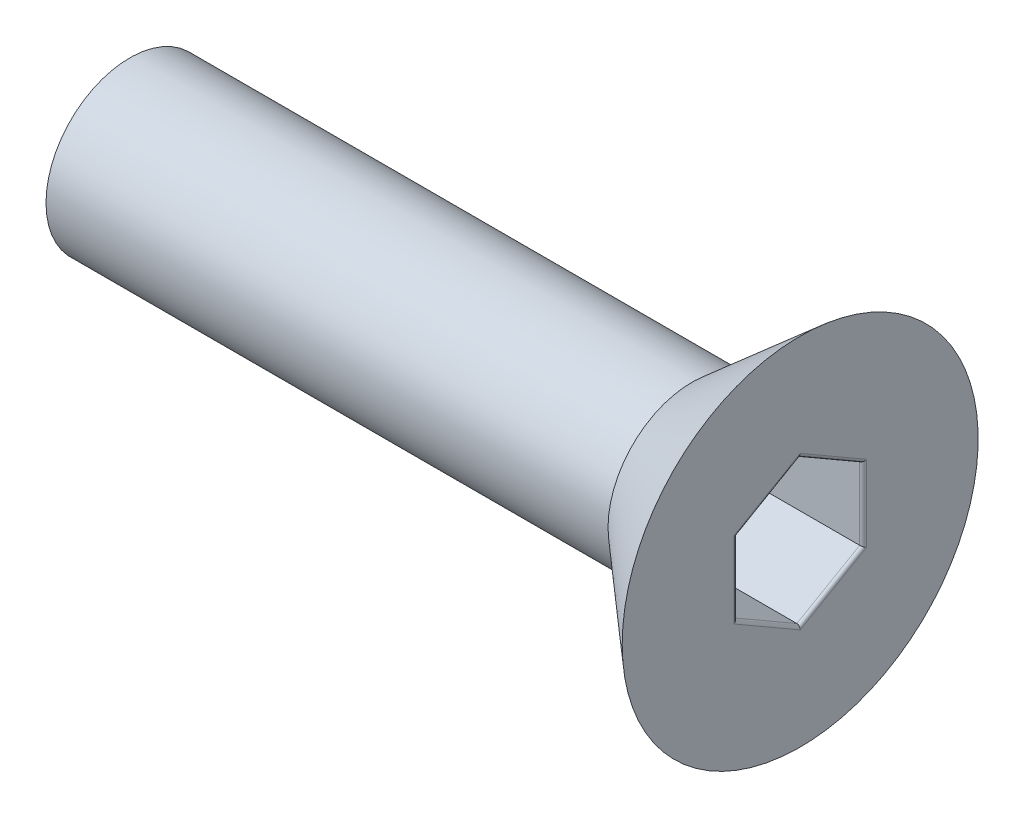
from build123d import *

# Parameters (mm, degrees)
CUT_EXTRUDE1_DEPTH = 3.81
FILLET1_R          = 0.127


with BuildPart() as part:
    # Sketch1 → Revolve1 (revolve)
    with BuildSketch(Plane(origin=(0, 0, 0), x_dir=(1, 0, 0), z_dir=(0, 1, 0)), mode=Mode.PRIVATE) as revolve1_sk:
        Polygon((0, 0), (0, 6.7437), (-4.105319735, 3.175), (-25.4, 3.175), (-25.4, 0), align=None)
    revolve(revolve1_sk.sketch.rotate(Axis((-25.4, 0, 0), (1, 0, 0)), 180), axis=Axis((-25.4, 0, 0), (1, 0, 0)))

    # Sketch2 → Cut-Extrude1 (cut)
    with BuildSketch(Plane(origin=(0, 0, 0), x_dir=(0, 0, -1), z_dir=(1, 0, 0))):
        Polygon((0, 2.749630657), (-2.38125, 1.374815329), (-2.38125, -1.374815329), (0, -2.749630657), (2.38125, -1.374815329), (2.38125, 1.374815329), align=None)
    extrude(amount=-CUT_EXTRUDE1_DEPTH, mode=Mode.SUBTRACT)

    # Fillet1
    fillet1_edges = [part.edges().sort_by_distance(p)[0] for p in [
        (0, 2.062222993, -1.190625),
        (0, 2.062222993, 1.190625),
        (0, 0, 2.38125),
        (0, -2.062222993, 1.190625),
        (0, -2.062222993, -1.190625),
        (0, 0, -2.38125),
    ]]
    fillet(fillet1_edges, radius=FILLET1_R)


solid = part.part
